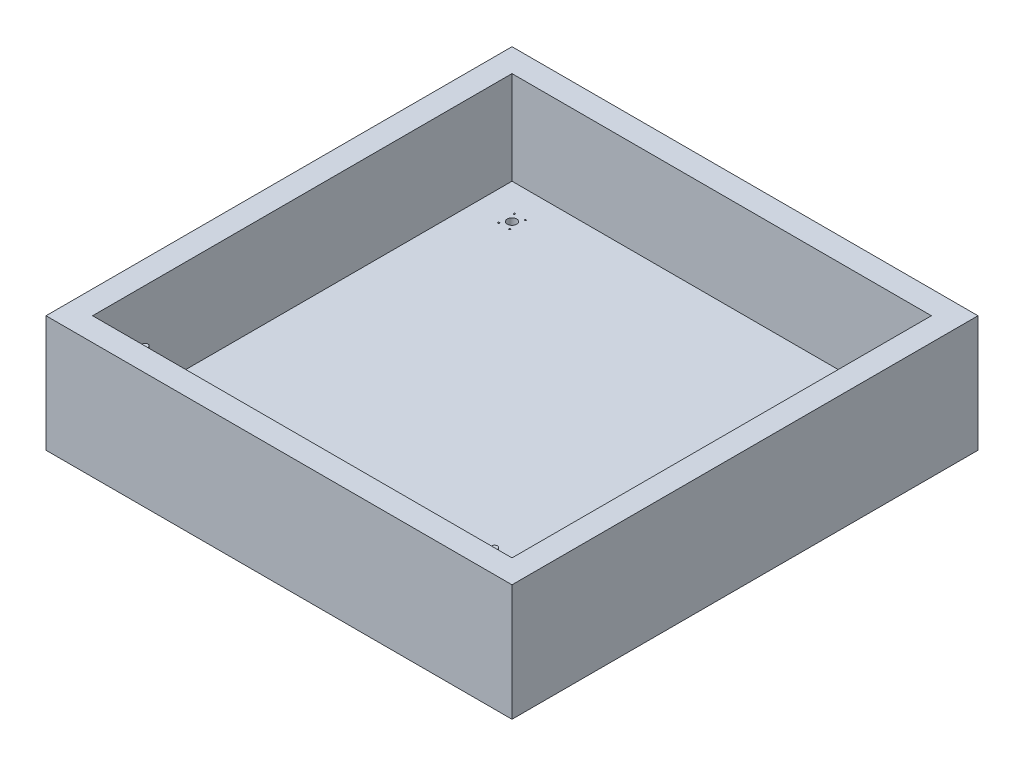
from build123d import *

# Parameters (mm, degrees)
SKETCH1_W           = 508
SKETCH1_H           = 508
SKETCH1_W_2         = 457.2
SKETCH1_H_2         = 457.2
BOSS_EXTRUDE1_DEPTH = 101.6
SKETCH2_W           = 508
SKETCH2_H           = 508
BOSS_EXTRUDE2_DEPTH = 25.4
SKETCH3_R           = 0.8
SKETCH3_R_2         = 5.08
SKETCH3_R_3         = 3.175
CUT_EXTRUDE1_DEPTH  = 29.21
SKETCH4_R           = 3.175
BOSS_EXTRUDE3_DEPTH = 82.804
SKETCH5_R           = 3.175
BOSS_EXTRUDE4_DEPTH = 82.804


with BuildPart() as part:
    # Sketch1 → Boss-Extrude1 (new body)
    with BuildSketch(Plane(origin=(0, 0, 0), x_dir=(1, 0, 0), z_dir=(0, 1, 0))):
        Rectangle(SKETCH1_W, SKETCH1_H)
        Rectangle(SKETCH1_W_2, SKETCH1_H_2, mode=Mode.SUBTRACT)
    extrude(amount=BOSS_EXTRUDE1_DEPTH)

    # Sketch2 → Boss-Extrude2 (add)
    with BuildSketch(Plane.XZ):
        Rectangle(SKETCH2_W, SKETCH2_H)
    extrude(amount=BOSS_EXTRUDE2_DEPTH)

    # Sketch3 → Cut-Extrude1 (cut)
    with BuildSketch(Plane(origin=(0, 0, 0), x_dir=(1, 0, 0), z_dir=(0, 1, 0))):
        with Locations(Location((-184.596, 182.126, 0), (0, 0, 270))):
            Circle(SKETCH3_R)
        with Locations(Location((-184.596, 199.126, 0), (0, 0, 270))):
            Circle(SKETCH3_R)
        with Locations(Location((-196.596, 199.126, 0), (0, 0, 270))):
            Circle(SKETCH3_R)
        with Locations(Location((-196.596, 182.126, 0), (0, 0, 270))):
            Circle(SKETCH3_R)
        with Locations(Location((-190.5, 190.5, 0), (0, 0, 270))):
            Circle(SKETCH3_R_2)
        with Locations(Location((190.5, 190.5, 0), (0, 0, 270))):
            Circle(SKETCH3_R_2)
        with Locations(Location((196.596, 182.126, 0), (0, 0, 270))):
            Circle(SKETCH3_R)
        with Locations(Location((196.596, 199.126, 0), (0, 0, 270))):
            Circle(SKETCH3_R)
        with Locations(Location((184.596, 199.126, 0), (0, 0, 270))):
            Circle(SKETCH3_R)
        with Locations(Location((184.596, 182.126, 0), (0, 0, 270))):
            Circle(SKETCH3_R)
        with Locations(Location((-190.5, -209.55, 0), (0, 0, 270))):
            Circle(SKETCH3_R_3)
        with Locations(Location((190.5, -209.55, 0), (0, 0, 270))):
            Circle(SKETCH3_R_3)
    extrude(amount=-CUT_EXTRUDE1_DEPTH, mode=Mode.SUBTRACT)


with BuildPart() as body_2:
    # Sketch4 → Boss-Extrude3 (new body)
    with BuildSketch(Plane(origin=(0, 0, 0), x_dir=(1, 0, 0), z_dir=(0, 1, 0))):
        with Locations(Location((190.5, -209.55, 0), (0, 0, 270))):
            Circle(SKETCH4_R)
    extrude(amount=BOSS_EXTRUDE3_DEPTH)


with BuildPart() as body_3:
    # Sketch5 → Boss-Extrude4 (new body)
    with BuildSketch(Plane(origin=(0, 0, 0), x_dir=(1, 0, 0), z_dir=(0, 1, 0))):
        with Locations(Location((-190.5, -209.55, 0), (0, 0, 270))):
            Circle(SKETCH5_R)
    extrude(amount=BOSS_EXTRUDE4_DEPTH)


solid = Compound([part.part, body_2.part, body_3.part])
